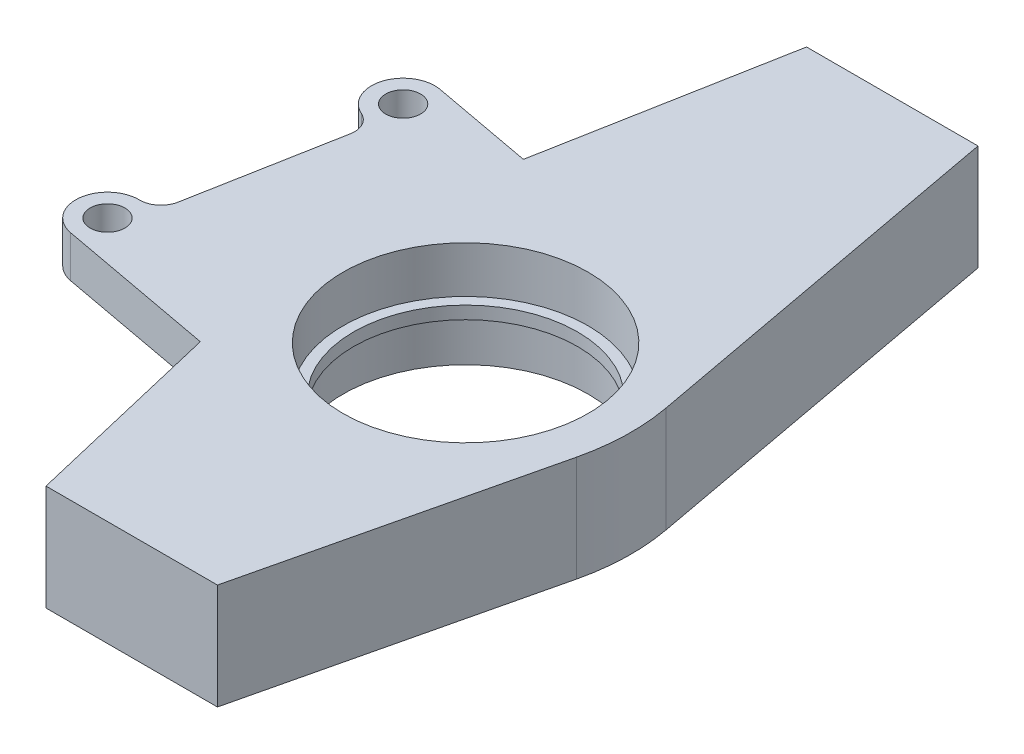
from build123d import *

# Parameters (mm, degrees)
SKETCH1_R                      = 29.464
BASE_DEPTH                     = 25.4
FILLET2_R                      = 50.8
BOSS_EXTRUDE3_DEPTH            = 10
MID_FEATURE_BEARING_DEPTH      = 1.524
MID_FEATURE_BEARING_DEPTH_BACK = 1.524
SKETCH8_R                      = 29.464
SKETCH8_R_2                    = 26.924


with BuildPart() as part:
    # Sketch1 → Base (new body)
    with BuildSketch(Plane(origin=(0, 0, 0), x_dir=(1, 0, 0), z_dir=(0, 1, 0))):
        Polygon((-20.613470334, -80.279427719), (20.613470334, -80.279427719), (39.624, 0), (20.613470334, 102.600572281), (-20.613470334, 102.600572281), (-39.624, 0), align=None)
        with Locations(Location((0, 0, 0), (0, 0, 270))):
            Circle(SKETCH1_R, mode=Mode.SUBTRACT)
    extrude(amount=BASE_DEPTH)

    # Fillet2
    fillet2_edges = [part.edges().sort_by_distance(p)[0] for p in [
        (39.624, 12.7, 0),
    ]]
    fillet(fillet2_edges, radius=FILLET2_R)

    # Sketch3 → Boss-Extrude3 (add)
    with BuildSketch(Plane(origin=(0, 25.4, 0), x_dir=(-1, 0, 0), z_dir=(0, -1, 0))):
        with BuildLine():
            Line((51.614471231, 48.928527053), (31.257084114, 45.156572344))
            Line((31.257084114, 45.156572344), (39.624, 0))
            Line((39.624, 0), (32.127488633, -31.65696343))
            Line((32.127488633, -31.65696343), (66.470159483, -25.293720531))
            ThreePointArc((66.470159483, -25.293720531), (67.22595128, -23.21046907), (67.916469509, -21.10468122))
            ThreePointArc((67.916469509, -21.10468122), (64.973148378, -16.061787909), (69.92712938, -12.971159419))
            ThreePointArc((69.92712938, -12.971159419), (70.219719772, -11.280308293), (70.471431194, -9.582890245))
            ThreePointArc((70.471431194, -9.582890245), (69.706370171, -9.476600605), (68.934479365, -9.448308557))
            ThreePointArc((68.934479365, -9.448308557), (65.642119146, -8.297198831), (63.868033442, -5.294315329))
            Line((63.868033442, -5.294315329), (57.38681967, 29.685048936))
            ThreePointArc((57.38681967, 29.685048936), (57.887770412, 32.979114965), (60.322037489, 35.25423396))
            ThreePointArc((60.322037489, 35.25423396), (60.883831005, 35.531602368), (61.420938914, 35.854186128))
            ThreePointArc((61.420938914, 35.854186128), (60.538035517, 37.32560322), (59.61988942, 38.775290915))
            ThreePointArc((59.61988942, 38.775290915), (53.859768583, 39.731805511), (54.646150047, 45.517608517))
            ThreePointArc((54.646150047, 45.517608517), (53.157675832, 47.247390405), (51.614471231, 48.928527053))
        make_face()
        with BuildLine():
            Line((55.84413555, 49.712227935), (51.614471231, 48.928527053))
            ThreePointArc((51.614471231, 48.928527053), (53.157675832, 47.247390405), (54.646150047, 45.517608517))
            ThreePointArc((54.646150047, 45.517608517), (59.06617769, 45.988270979), (61.423391664, 42.219755382))
            ThreePointArc((61.423391664, 42.219755382), (60.945239903, 40.275728903), (59.61988942, 38.775290915))
            ThreePointArc((59.61988942, 38.775290915), (60.538035517, 37.32560322), (61.420938914, 35.854186128))
            ThreePointArc((61.420938914, 35.854186128), (64.301460789, 45.064515776), (55.84413555, 49.712227935))
        make_face()
        with BuildLine():
            ThreePointArc((67.916469509, -21.10468122), (67.22595128, -23.21046907), (66.470159483, -25.293720531))
            Line((66.470159483, -25.293720531), (70.42993181, -24.560027067))
            ThreePointArc((70.42993181, -24.560027067), (76.661646445, -17.088668302), (70.471431194, -9.582890245))
            ThreePointArc((70.471431194, -9.582890245), (70.219719772, -11.280308293), (69.92712938, -12.971159419))
            ThreePointArc((69.92712938, -12.971159419), (72.303225741, -14.435678319), (73.232675696, -17.067554514))
            ThreePointArc((73.232675696, -17.067554514), (71.576309977, -20.405234856), (67.916469509, -21.10468122))
        make_face()
    extrude(amount=BOSS_EXTRUDE3_DEPTH)

    # Sketch8 → mid-feature bearing (add, two sides: drawn at the far end of the back side and taken through both)
    with BuildSketch(Plane(origin=(0, 12.7, 0), x_dir=(1, 0, 0), z_dir=(0, 1, 0)).offset(-MID_FEATURE_BEARING_DEPTH_BACK)):
        with Locations(Location((0, 0, 0), (0, 0, 270))):
            Circle(SKETCH8_R)
        with Locations(Location((0, 0, 0), (0, 0, 270))):
            Circle(SKETCH8_R_2, mode=Mode.SUBTRACT)
    extrude(amount=MID_FEATURE_BEARING_DEPTH + MID_FEATURE_BEARING_DEPTH_BACK)


solid = part.part
